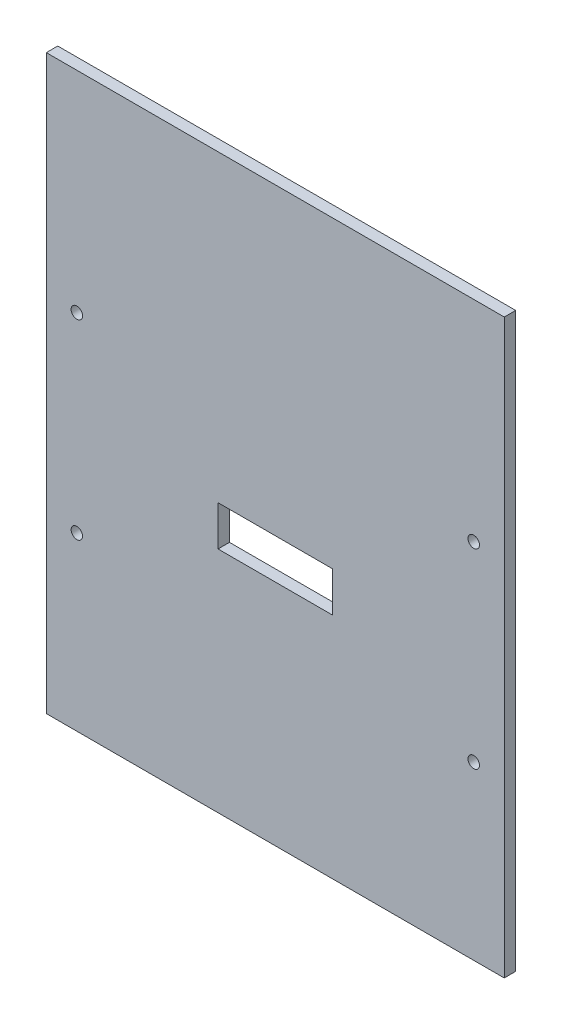
from build123d import *

# Parameters (mm, degrees)
SKETCH1_W           = 120
SKETCH1_H           = 150
SKETCH1_R           = 1.5
BOSS_EXTRUDE1_DEPTH = 3
SKETCH2_R           = 2.403365395
SKETCH2_R_2         = 1.25
SKETCH2_R_3         = 2.397656746
BOSS_EXTRUDE2_DEPTH = 4
SKETCH3_W           = 30
SKETCH3_H           = 10.5
CUT_EXTRUDE1_DEPTH  = 10


with BuildPart() as part:
    # Sketch1 → Boss-Extrude1 (new body)
    with BuildSketch(Plane.XY):
        with Locations((60, 75)):
            Rectangle(SKETCH1_W, SKETCH1_H)
        with Locations((112, 95)):
            Circle(SKETCH1_R, mode=Mode.SUBTRACT)
        with Locations((112, 45)):
            Circle(SKETCH1_R, mode=Mode.SUBTRACT)
        with Locations(Location((8, 45, 0), (0, 0, 180))):
            Circle(SKETCH1_R, mode=Mode.SUBTRACT)
        with Locations(Location((8, 95, 0), (0, 0, 180))):
            Circle(SKETCH1_R, mode=Mode.SUBTRACT)
    extrude(amount=BOSS_EXTRUDE1_DEPTH)

    # Sketch2 → Boss-Extrude2 (add)
    # profile 1 of 4: a face of its own
    with BuildSketch(Plane(origin=(0, 0, 0), x_dir=(-1, 0, 0), z_dir=(0, 0, -1))):
        with Locations(Location((-42.75, 53.304125965, 0), (0, 0, 180))):
            Circle(SKETCH2_R)
        with Locations(Location((-42.75, 53.304125965, 0), (0, 0, 180))):
            Circle(SKETCH2_R_2, mode=Mode.SUBTRACT)
    # profile 2 of 4: a face of its own
    with BuildSketch(Plane(origin=(0, 0, 0), x_dir=(-1, 0, 0), z_dir=(0, 0, -1))):
        with Locations(Location((-47.6, 16.154125965, 0), (0, 0, 180))):
            Circle(SKETCH2_R_3)
        with Locations(Location((-47.6, 16.154125965, 0), (0, 0, 180))):
            Circle(SKETCH2_R_2, mode=Mode.SUBTRACT)
    # profile 3 of 4: a face of its own
    with BuildSketch(Plane(origin=(0, 0, 0), x_dir=(-1, 0, 0), z_dir=(0, 0, -1))):
        with Locations((-72.4, 16.154125965)):
            Circle(SKETCH2_R_3)
        with Locations((-72.4, 16.154125965)):
            Circle(SKETCH2_R_2, mode=Mode.SUBTRACT)
    # profile 4 of 4: a face of its own
    with BuildSketch(Plane(origin=(0, 0, 0), x_dir=(-1, 0, 0), z_dir=(0, 0, -1))):
        with Locations((-77.25, 53.304125965)):
            Circle(SKETCH2_R)
        with Locations((-77.25, 53.304125965)):
            Circle(SKETCH2_R_2, mode=Mode.SUBTRACT)
    extrude(amount=BOSS_EXTRUDE2_DEPTH)

    # Sketch3 → Cut-Extrude1 (cut)
    with BuildSketch(Plane(origin=(0, 0, 0), x_dir=(-1, 0, 0), z_dir=(0, 0, -1))):
        with Locations((-60, 65.111028977)):
            Rectangle(SKETCH3_W, SKETCH3_H)
    extrude(amount=-CUT_EXTRUDE1_DEPTH, mode=Mode.SUBTRACT)


solid = part.part
